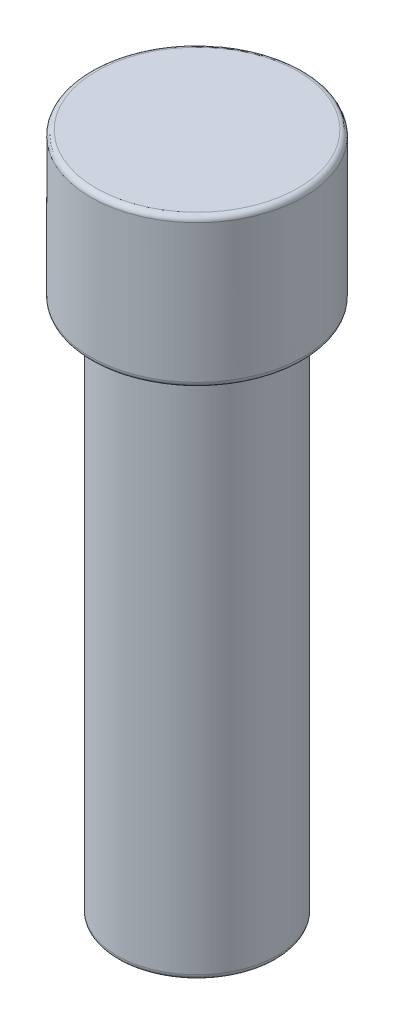
from build123d import *

# Parameters (mm, degrees)
TROU_TARAUD_M2_51_D     = 2.05
TROU_TARAUD_M2_51_DEPTH = 9.25
TROU_TARAUD_M2_51_TIP   = 0.615882135
CONG_1_R                = 0.2


with BuildPart() as part:
    # Esquisse1 → Révolution1 (revolve)
    with BuildSketch(Plane.XY, mode=Mode.PRIVATE) as r_volution1_sk:
        Polygon((0, 25.6), (4, 25.6), (4, 20), (3, 20), (3, 0), (0, 0), align=None)
    revolve(r_volution1_sk.sketch.rotate(Axis((0, 0, 0), (0, 1, 0)), 90), axis=Axis((0, 0, 0), (0, 1, 0)))

    # Trou taraudé M2.51
    with Locations(Plane(origin=(0, 0, 0), x_dir=(-1, 0, 0), z_dir=(0, -1, 0))):
        with Locations((0, 0)):
            Hole(TROU_TARAUD_M2_51_D / 2, depth=TROU_TARAUD_M2_51_DEPTH)
            with Locations((0, 0, -(TROU_TARAUD_M2_51_DEPTH + TROU_TARAUD_M2_51_TIP / 2))):  # 118° drill point
                Cone(0, TROU_TARAUD_M2_51_D / 2, TROU_TARAUD_M2_51_TIP, mode=Mode.SUBTRACT)

    # Congé1
    cong_1_edges = [part.edges().sort_by_distance(p)[0] for p in [
        (0, 0, 3),
        (0, 20, 4),
        (0, 25.6, 4),
    ]]
    fillet(cong_1_edges, radius=CONG_1_R)


solid = part.part
